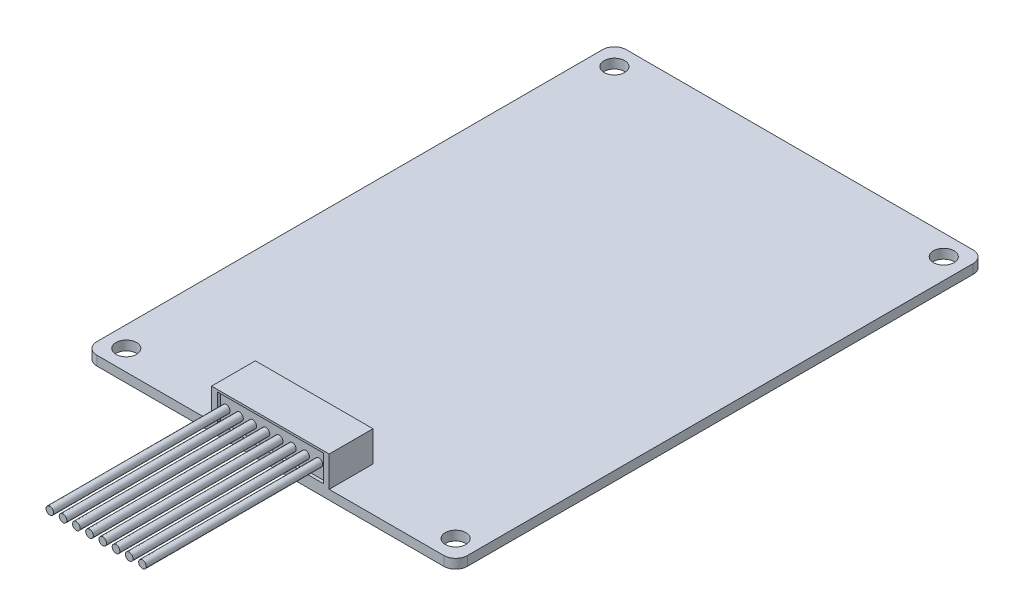
from build123d import *

# Parameters (mm, degrees)
SKETCH1_R           = 1.75
BOSS_EXTRUDE1_DEPTH = 0.8
SKETCH2_W           = 20
SKETCH2_H           = 7.45
BOSS_EXTRUDE2_DEPTH = 5.2
SKETCH3_W           = 18
SKETCH3_H           = 4.5
CUT_EXTRUDE1_DEPTH  = 0.5
SKETCH4_R           = 0.65
BOSS_EXTRUDE3_DEPTH = 30


with BuildPart() as part:
    # Sketch1 → Boss-Extrude1 (new, symmetric)
    with BuildSketch(Plane(origin=(0, 0, 0), x_dir=(1, 0, 0), z_dir=(0, 1, 0))):
        with BuildLine():
            Line((29.5, -45), (-29.5, -45))
            ThreePointArc((-29.5, -45), (-30.914213562, -44.414213562), (-31.5, -43))
            Line((-31.5, -43), (-31.5, 43))
            ThreePointArc((-31.5, 43), (-30.914213562, 44.414213562), (-29.5, 45))
            Line((-29.5, 45), (29.5, 45))
            ThreePointArc((29.5, 45), (30.914213562, 44.414213562), (31.5, 43))
            Line((31.5, 43), (31.5, -43))
            ThreePointArc((31.5, -43), (30.914213562, -44.414213562), (29.5, -45))
        make_face()
        with Locations(Location((-28, 41.5, 0), (0, 0, 270))):
            Circle(SKETCH1_R, mode=Mode.SUBTRACT)
        with Locations(Location((28, 41.5, 0), (0, 0, 90))):
            Circle(SKETCH1_R, mode=Mode.SUBTRACT)
        with Locations(Location((28, -41.5, 0), (0, 0, 270))):
            Circle(SKETCH1_R, mode=Mode.SUBTRACT)
        with Locations(Location((-28, -41.5, 0), (0, 0, 90))):
            Circle(SKETCH1_R, mode=Mode.SUBTRACT)
    extrude(amount=BOSS_EXTRUDE1_DEPTH, both=True)

    # Sketch2 → Boss-Extrude2 (add)
    with BuildSketch(Plane(origin=(0, 0.8, 0), x_dir=(1, 0, 0), z_dir=(0, 1, 0))):
        with Locations((0, -41.275)):
            Rectangle(SKETCH2_W, SKETCH2_H)
    extrude(amount=BOSS_EXTRUDE2_DEPTH)

    # Sketch3 → Cut-Extrude1 (cut)
    with BuildSketch(Plane.XY.offset(45)):
        with Locations((0, 3.4)):
            Rectangle(SKETCH3_W, SKETCH3_H)
    extrude(amount=-CUT_EXTRUDE1_DEPTH, mode=Mode.SUBTRACT)

    # Sketch4 → Boss-Extrude3 (add)
    with BuildSketch(Plane.XY.offset(44.5)):
        with Locations((-8, 3.4)):
            Circle(SKETCH4_R)
        with Locations((-5.75, 3.4)):
            Circle(SKETCH4_R)
        with Locations((-3.5, 3.4)):
            Circle(SKETCH4_R)
        with Locations((-1.25, 3.4)):
            Circle(SKETCH4_R)
        with Locations((1, 3.4)):
            Circle(SKETCH4_R)
        with Locations((3.25, 3.4)):
            Circle(SKETCH4_R)
        with Locations((5.5, 3.4)):
            Circle(SKETCH4_R)
        with Locations((7.75, 3.4)):
            Circle(SKETCH4_R)
    extrude(amount=BOSS_EXTRUDE3_DEPTH)


solid = part.part
